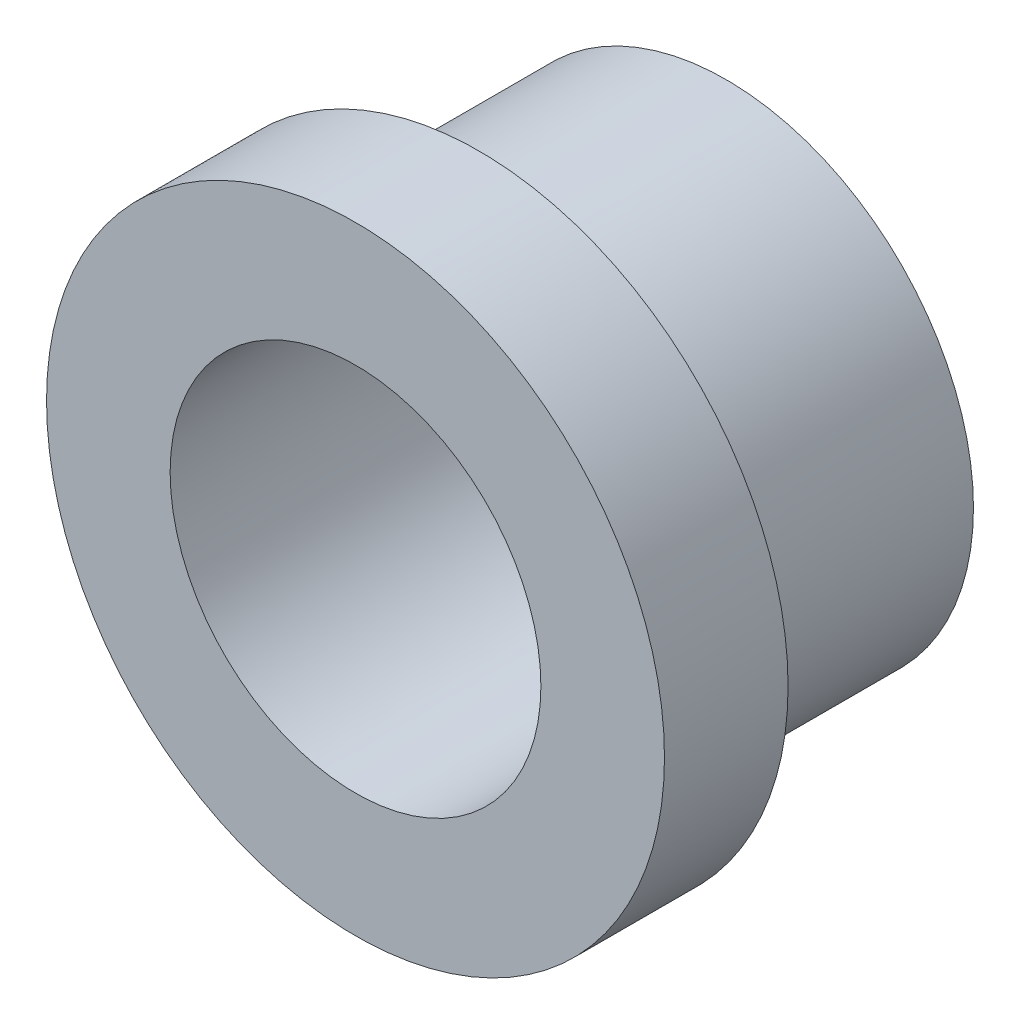
from build123d import *

# Parameters (mm, degrees)
SKETCH1_R           = 6.35
SKETCH1_R_2         = 4.7625
BOSS_EXTRUDE1_DEPTH = 6.35
SKETCH2_R           = 7.9375
SKETCH2_R_2         = 4.7625
BOSS_EXTRUDE2_DEPTH = 3.175


with BuildPart() as part:
    # Sketch1 → Boss-Extrude1 (new body)
    with BuildSketch(Plane.XY):
        Circle(SKETCH1_R)
        Circle(SKETCH1_R_2, mode=Mode.SUBTRACT)
    extrude(amount=BOSS_EXTRUDE1_DEPTH)

    # Sketch2 → Boss-Extrude2 (add)
    with BuildSketch(Plane.XY.offset(6.35)):
        Circle(SKETCH2_R)
        Circle(SKETCH2_R_2, mode=Mode.SUBTRACT)
    extrude(amount=BOSS_EXTRUDE2_DEPTH)


solid = part.part
